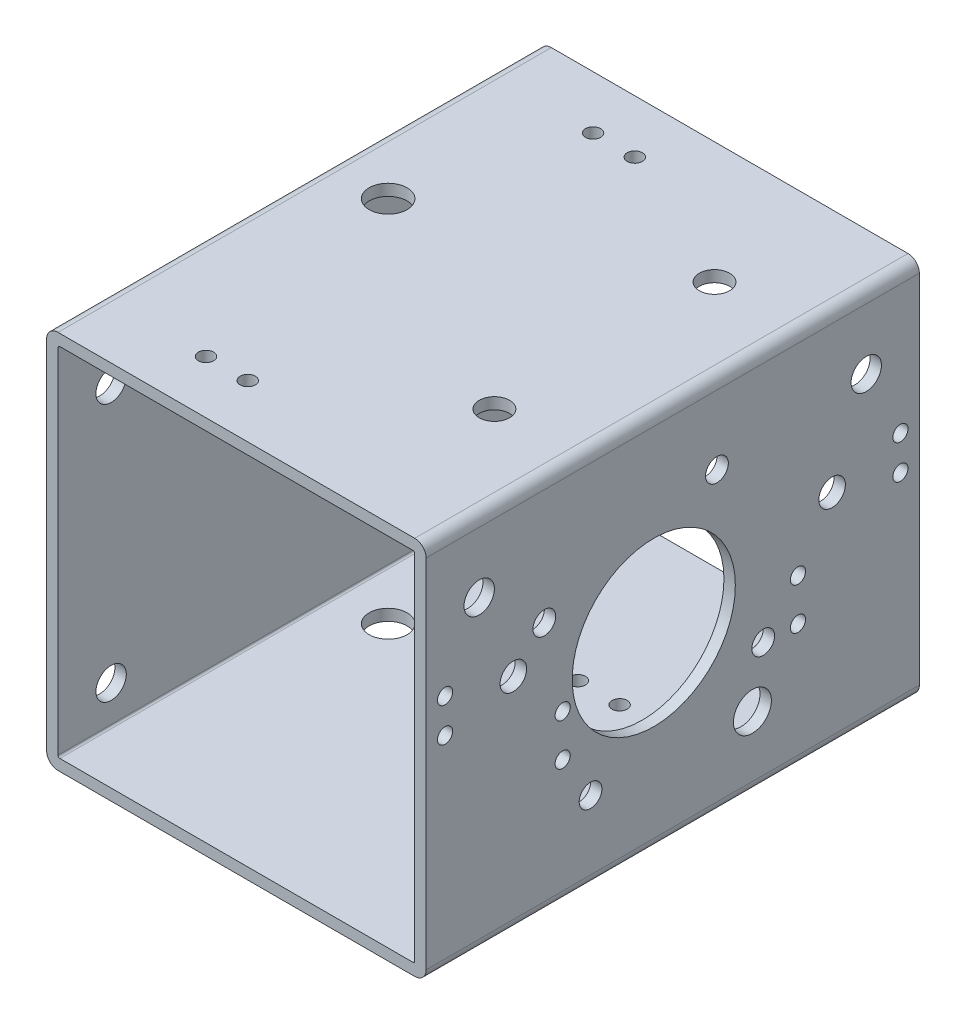
from build123d import *

# Parameters (mm, degrees)
SKETCH1_W                      = 100
SKETCH1_H                      = 100
SKETCH1_W_2                    = 94
SKETCH1_H_2                    = 94
EXTRUDE_THIN1_DEPTH            = 130
FILLET1_R                      = 0.5
FILLET2_R                      = 3
F_8_0_8_DIAMETER_HOLE2_D       = 8
F_8_0_8_DIAMETER_HOLE3_D       = 8
F_10_0_10_DIAMETER_HOLE1_D     = 10
F_10_0_10_DIAMETER_HOLE2_D     = 10
F_21_0_21_DIAMETER_HOLE1_D     = 43
F_21_0_21_DIAMETER_HOLE1_DEPTH = 3
F_6_0_6_DIAMETER_HOLE1_D       = 6
F_6_0_6_DIAMETER_HOLE1_DEPTH   = 3
CUT_EXTRUDE1_REACH             = 173.464
SKETCH27_R                     = 2
SKETCH27_R_2                   = 3.5
CUT_EXTRUDE2_REACH             = 173.464
SKETCH31_R                     = 4
SKETCH34_R                     = 2
CUT_EXTRUDE3_DEPTH             = 10
SKETCH35_R                     = 2
CUT_EXTRUDE4_DEPTH             = 10
SKETCH36_R                     = 2
CUT_EXTRUDE5_DEPTH             = 10
SKETCH37_R                     = 2
CUT_EXTRUDE6_DEPTH             = 10
SKETCH38_R                     = 3.1
CUT_EXTRUDE7_DEPTH             = 10
SKETCH39_R                     = 3.1
CUT_EXTRUDE8_DEPTH             = 10


with BuildPart() as part:
    # Sketch1 → Extrude-Thin1 (new body)
    with BuildSketch(Plane.XY):
        Rectangle(SKETCH1_W, SKETCH1_H)
        Rectangle(SKETCH1_W_2, SKETCH1_H_2, mode=Mode.SUBTRACT)
    extrude(amount=EXTRUDE_THIN1_DEPTH)

    # Fillet1
    fillet1_edges = [part.edges().sort_by_distance(p)[0] for p in [
        (47, -47, 65),
        (47, 47, 65),
        (-47, 47, 65),
        (-47, -47, 65),
    ]]
    fillet(fillet1_edges, radius=FILLET1_R)

    # Fillet2
    fillet2_edges = [part.edges().sort_by_distance(p)[0] for p in [
        (50, -50, 65),
        (-50, -50, 65),
        (-50, 50, 65),
        (50, 50, 65),
    ]]
    fillet(fillet2_edges, radius=FILLET2_R)

    # Ø8.0 (8) Diameter Hole2 (through all)
    with Locations(Plane(origin=(0, 50, 0), x_dir=(1, 0, 0), z_dir=(0, 1, 0))):
        with Locations((28, -32), (28, -90)):
            Hole(F_8_0_8_DIAMETER_HOLE2_D / 2)

    # Ø8.0 (8) Diameter Hole3 (through all)
    with Locations(Plane(origin=(50, 0, 0), x_dir=(0, 0, -1), z_dir=(1, 0, 0))):
        with Locations((-14, 31), (-116, 31)):
            Hole(F_8_0_8_DIAMETER_HOLE3_D / 2)

    # Ø10.0 (10) Diameter Hole1 (through all)
    with Locations(Plane(origin=(0, 50, 0), x_dir=(1, 0, 0), z_dir=(0, 1, 0))):
        with Locations((-34, -56)):
            Hole(F_10_0_10_DIAMETER_HOLE1_D / 2)

    # Ø10.0 (10) Diameter Hole2 (through all)
    with Locations(Plane(origin=(50, 0, 0), x_dir=(0, 0, -1), z_dir=(1, 0, 0))):
        with Locations((-44, -31)):
            Hole(F_10_0_10_DIAMETER_HOLE2_D / 2)

    # Ø21.0 (21) Diameter Hole1
    with Locations(Plane(origin=(50, 0, 0), x_dir=(0, 0, -1), z_dir=(1, 0, 0))):
        with Locations((-70, 0)):
            Hole(F_21_0_21_DIAMETER_HOLE1_D / 2, depth=F_21_0_21_DIAMETER_HOLE1_DEPTH)

    # Ø6.0 (6) Diameter Hole1
    with Locations(Plane(origin=(50, 0, 0), x_dir=(0, 0, -1), z_dir=(1, 0, 0))):
        with Locations((-41.157258279, -16.652364697), (-53.347635303, 28.842741721), (-98.842741721, 16.652364697), (-86.652364697, -28.842741721)):
            Hole(F_6_0_6_DIAMETER_HOLE1_D / 2, depth=F_6_0_6_DIAMETER_HOLE1_DEPTH)

    # Sketch27 → Cut-Extrude1 (cut, up to next)
    with BuildSketch(Plane(origin=(50, 0, 0), x_dir=(0, 0, -1), z_dir=(1, 0, 0)), mode=Mode.PRIVATE) as cut_extrude1_sk1:
        with Locations(Location((-5, 13, 0), (0, 0, 90))):
            Circle(SKETCH27_R)
    cut_extrude1_tool1 = extrude(cut_extrude1_sk1.sketch, amount=-CUT_EXTRUDE1_REACH, mode=Mode.PRIVATE) & part.part
    # Sketch27 → Cut-Extrude1 (cut, up to next)
    with BuildSketch(Plane(origin=(50, 0, 0), x_dir=(0, 0, -1), z_dir=(1, 0, 0)), mode=Mode.PRIVATE) as cut_extrude1_sk2:
        with Locations(Location((-5, 4, 0), (0, 0, 90))):
            Circle(SKETCH27_R)
    cut_extrude1_tool2 = extrude(cut_extrude1_sk2.sketch, amount=-CUT_EXTRUDE1_REACH, mode=Mode.PRIVATE) & part.part
    # Sketch27 → Cut-Extrude1 (cut, up to next)
    with BuildSketch(Plane(origin=(50, 0, 0), x_dir=(0, 0, -1), z_dir=(1, 0, 0)), mode=Mode.PRIVATE) as cut_extrude1_sk3:
        with Locations(Location((-23, 8.5, 0), (0, 0, 90))):
            Circle(SKETCH27_R_2)
    cut_extrude1_tool3 = extrude(cut_extrude1_sk3.sketch, amount=-CUT_EXTRUDE1_REACH, mode=Mode.PRIVATE) & part.part
    # Sketch27 → Cut-Extrude1 (cut, up to next)
    with BuildSketch(Plane(origin=(50, 0, 0), x_dir=(0, 0, -1), z_dir=(1, 0, 0)), mode=Mode.PRIVATE) as cut_extrude1_sk4:
        with Locations(Location((-107, 8.5, 0), (0, 0, 270))):
            Circle(SKETCH27_R_2)
    cut_extrude1_tool4 = extrude(cut_extrude1_sk4.sketch, amount=-CUT_EXTRUDE1_REACH, mode=Mode.PRIVATE) & part.part
    # Sketch27 → Cut-Extrude1 (cut, up to next)
    with BuildSketch(Plane(origin=(50, 0, 0), x_dir=(0, 0, -1), z_dir=(1, 0, 0)), mode=Mode.PRIVATE) as cut_extrude1_sk5:
        with Locations(Location((-125, 4, 0), (0, 0, 270))):
            Circle(SKETCH27_R)
    cut_extrude1_tool5 = extrude(cut_extrude1_sk5.sketch, amount=-CUT_EXTRUDE1_REACH, mode=Mode.PRIVATE) & part.part
    # Sketch27 → Cut-Extrude1 (cut, up to next)
    with BuildSketch(Plane(origin=(50, 0, 0), x_dir=(0, 0, -1), z_dir=(1, 0, 0)), mode=Mode.PRIVATE) as cut_extrude1_sk6:
        with Locations(Location((-125, 13, 0), (0, 0, 270))):
            Circle(SKETCH27_R)
    cut_extrude1_tool6 = extrude(cut_extrude1_sk6.sketch, amount=-CUT_EXTRUDE1_REACH, mode=Mode.PRIVATE) & part.part
    add(cut_extrude1_tool1.solids().sort_by_distance((50, 13, 5))[0], mode=Mode.SUBTRACT)
    add(cut_extrude1_tool2.solids().sort_by_distance((50, 4, 5))[0], mode=Mode.SUBTRACT)
    add(cut_extrude1_tool3.solids().sort_by_distance((50, 8.5, 23))[0], mode=Mode.SUBTRACT)
    add(cut_extrude1_tool4.solids().sort_by_distance((50, 8.5, 107))[0], mode=Mode.SUBTRACT)
    add(cut_extrude1_tool5.solids().sort_by_distance((50, 4, 125))[0], mode=Mode.SUBTRACT)
    add(cut_extrude1_tool6.solids().sort_by_distance((50, 13, 125))[0], mode=Mode.SUBTRACT)

    # Sketch31 → Cut-Extrude2 (cut, up to next)
    with BuildSketch(Plane.ZY.offset(50), mode=Mode.PRIVATE) as cut_extrude2_sk1:
        with Locations(Location((14, -37, 0), (0, 0, 270))):
            Circle(SKETCH31_R)
    cut_extrude2_tool1 = extrude(cut_extrude2_sk1.sketch, amount=-CUT_EXTRUDE2_REACH, mode=Mode.PRIVATE) & part.part
    # Sketch31 → Cut-Extrude2 (cut, up to next)
    with BuildSketch(Plane.ZY.offset(50), mode=Mode.PRIVATE) as cut_extrude2_sk2:
        with Locations(Location((116, -37, 0), (0, 0, 270))):
            Circle(SKETCH31_R)
    cut_extrude2_tool2 = extrude(cut_extrude2_sk2.sketch, amount=-CUT_EXTRUDE2_REACH, mode=Mode.PRIVATE) & part.part
    add(cut_extrude2_tool1.solids().sort_by_distance((-50, -37, 14))[0], mode=Mode.SUBTRACT)
    add(cut_extrude2_tool2.solids().sort_by_distance((-50, -37, 116))[0], mode=Mode.SUBTRACT)

    # Sketch34 → Cut-Extrude3 (cut)
    with BuildSketch(Plane(origin=(0, 50, 0), x_dir=(1, 0, 0), z_dir=(0, 1, 0))):
        with Locations(Location((-22, -14, 0), (0, 0, 270))):
            Circle(SKETCH34_R)
        with Locations(Location((-11, -14, 0), (0, 0, 270))):
            Circle(SKETCH34_R)
        with Locations(Location((-11, -116, 0), (0, 0, 90))):
            Circle(SKETCH34_R)
        with Locations(Location((-22, -116, 0), (0, 0, 90))):
            Circle(SKETCH34_R)
    extrude(amount=-CUT_EXTRUDE3_DEPTH, mode=Mode.SUBTRACT)

    # Sketch35 → Cut-Extrude4 (cut)
    with BuildSketch(Plane.XZ.offset(50)):
        with Locations(Location((15, 44, 0), (0, 0, 270))):
            Circle(SKETCH35_R)
        with Locations(Location((4, 44, 0), (0, 0, 270))):
            Circle(SKETCH35_R)
    extrude(amount=-CUT_EXTRUDE4_DEPTH, mode=Mode.SUBTRACT)

    # Sketch36 → Cut-Extrude5 (cut)
    with BuildSketch(Plane.ZY.offset(50)):
        with Locations(Location((56, 19, 0), (0, 0, 270))):
            Circle(SKETCH36_R)
        with Locations(Location((56, 8, 0), (0, 0, 270))):
            Circle(SKETCH36_R)
    extrude(amount=-CUT_EXTRUDE5_DEPTH, mode=Mode.SUBTRACT)

    # Sketch37 → Cut-Extrude6 (cut)
    with BuildSketch(Plane(origin=(50, 0, 0), x_dir=(0, 0, -1), z_dir=(1, 0, 0))):
        with Locations(Location((-32, -17, 0), (0, 0, 90))):
            Circle(SKETCH37_R)
        with Locations(Location((-32, -6, 0), (0, 0, 90))):
            Circle(SKETCH37_R)
        with Locations(Location((-94, -6, 0), (0, 0, 90))):
            Circle(SKETCH37_R)
        with Locations(Location((-94, -17, 0), (0, 0, 90))):
            Circle(SKETCH37_R)
    extrude(amount=-CUT_EXTRUDE6_DEPTH, mode=Mode.SUBTRACT)

    # Sketch38 → Cut-Extrude7 (cut)
    with BuildSketch(Plane.XZ.offset(50)):
        with Locations(Location((38, 44, 0), (0, 0, 270))):
            Circle(SKETCH38_R)
        with Locations(Location((-19, 44, 0), (0, 0, 270))):
            Circle(SKETCH38_R)
    extrude(amount=-CUT_EXTRUDE7_DEPTH, mode=Mode.SUBTRACT)

    # Sketch39 → Cut-Extrude8 (cut)
    with BuildSketch(Plane.ZY.offset(50)):
        with Locations(Location((56, 35, 0), (0, 0, 270))):
            Circle(SKETCH39_R)
        with Locations(Location((56, -15, 0), (0, 0, 270))):
            Circle(SKETCH39_R)
    extrude(amount=-CUT_EXTRUDE8_DEPTH, mode=Mode.SUBTRACT)


solid = part.part
